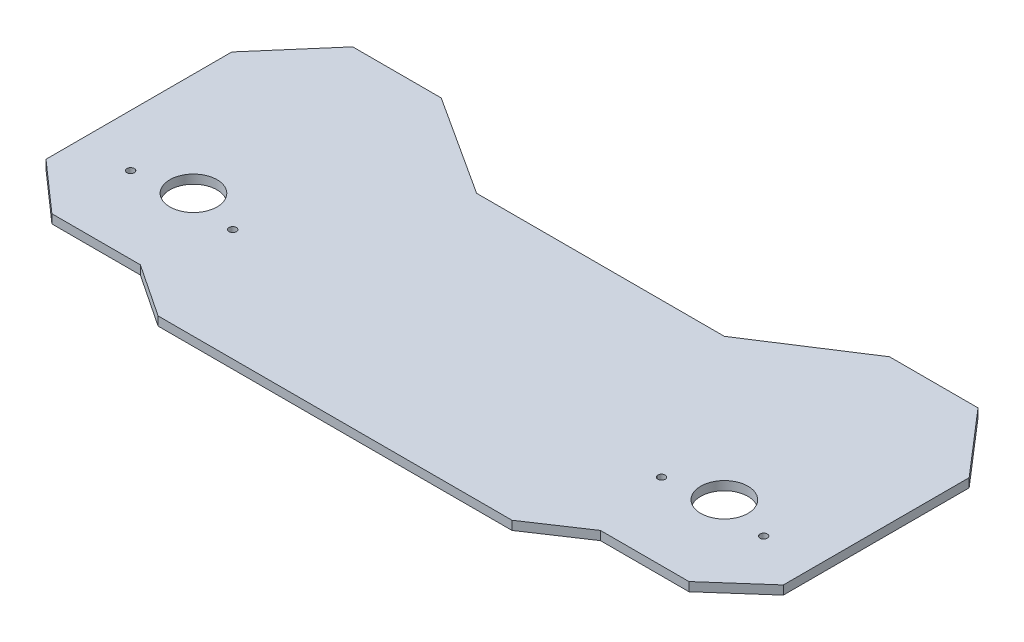
from build123d import *

# Parameters (mm, degrees)
SKETCH1_R           = 8
SKETCH1_R_2         = 1.25
BOSS_EXTRUDE1_DEPTH = 3


with BuildPart() as part:
    # Sketch1 → Boss-Extrude1 (new body)
    with BuildSketch(Plane(origin=(0, 0, 0), x_dir=(1, 0, 0), z_dir=(0, 1, 0))):
        Polygon((-42, 45), (42, 45), (76, 67), (106, 67), (125, 45), (125, -18), (108, -33), (78, -33), (60, -45), (-60, -45), (-78, -33), (-108, -33), (-125, -18), (-125, 45), (-106, 67), (-76, 67), align=None)
        with Locations(Location((-90, -3, 0), (0, 0, 270))):
            Circle(SKETCH1_R, mode=Mode.SUBTRACT)
        with Locations(Location((90, -3, 0), (0, 0, 270))):
            Circle(SKETCH1_R, mode=Mode.SUBTRACT)
        with Locations(Location((-72.7, -7, 0), (0, 0, 270))):
            Circle(SKETCH1_R_2, mode=Mode.SUBTRACT)
        with Locations(Location((-107.3, -7, 0), (0, 0, 270))):
            Circle(SKETCH1_R_2, mode=Mode.SUBTRACT)
        with Locations(Location((72.7, -7, 0), (0, 0, 270))):
            Circle(SKETCH1_R_2, mode=Mode.SUBTRACT)
        with Locations(Location((107.3, -7, 0), (0, 0, 270))):
            Circle(SKETCH1_R_2, mode=Mode.SUBTRACT)
    extrude(amount=BOSS_EXTRUDE1_DEPTH)


solid = part.part
